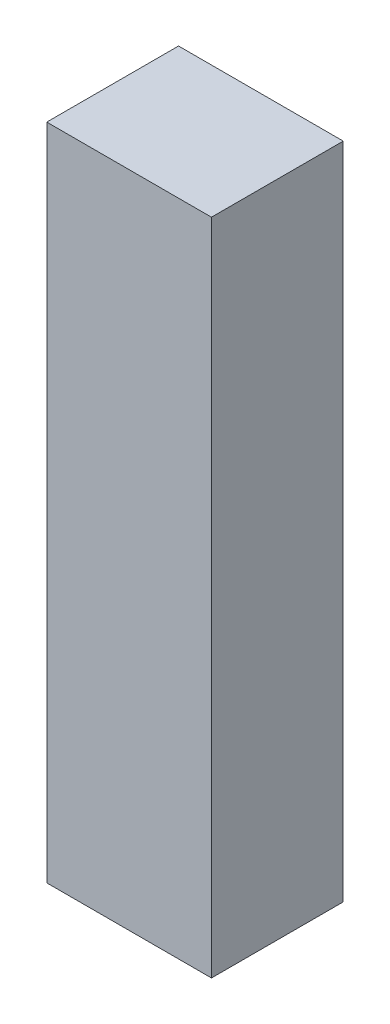
from build123d import *

# Parameters (mm, degrees)
TOPPING_ARKA_DUVAR_PANO_SURUCU_1_1_START = -736
SKETCH1_W                                = 50
SKETCH1_H                                = 200
TOPPING_ARKA_DUVAR_PANO_SURUCU_1_1_DEPTH = 40


with BuildPart() as part:
    # Sketch1 → TOPPING_arka_duvar_pano_surucu_1_1 (new body)
    with BuildSketch(Plane.XY.offset(TOPPING_ARKA_DUVAR_PANO_SURUCU_1_1_START)):
        with Locations((145, 430)):
            Rectangle(SKETCH1_W, SKETCH1_H)
    extrude(amount=-TOPPING_ARKA_DUVAR_PANO_SURUCU_1_1_DEPTH)


solid = part.part
